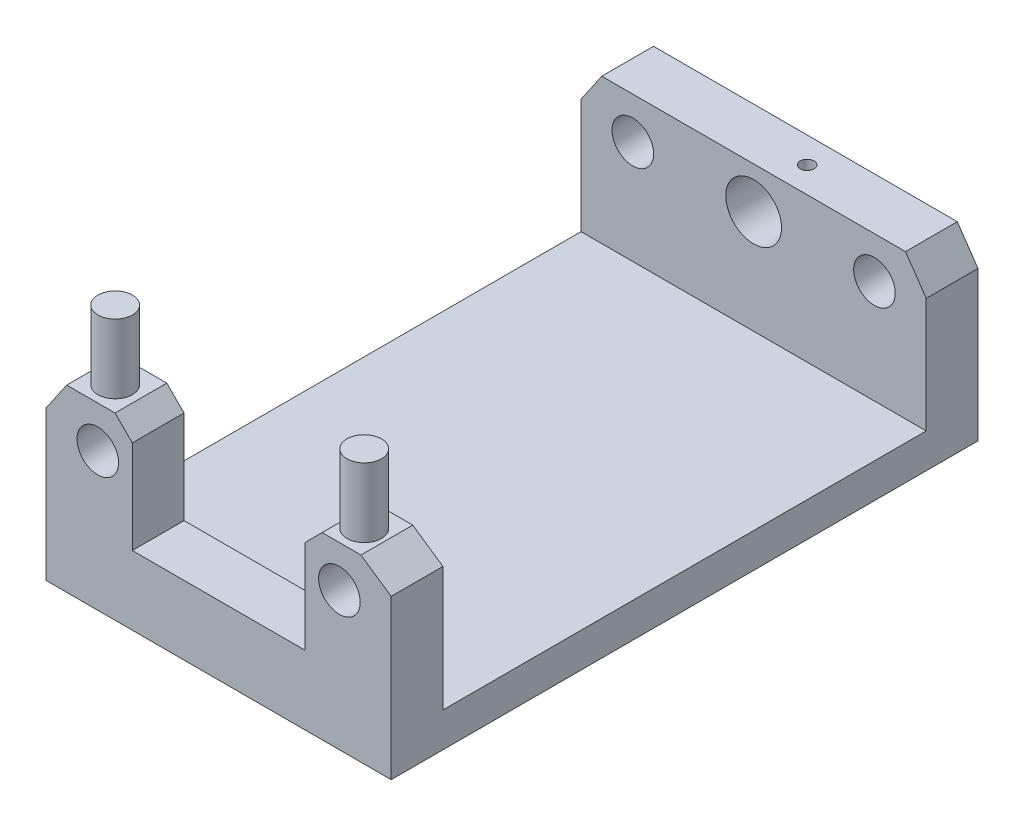
from build123d import *
from OCP.BRepFilletAPI import BRepFilletAPI_MakeChamfer

# Parameters (mm, degrees)
SKETCH1_W                      = 100
SKETCH1_H                      = 52
BOSS_EXTRUDE1_DEPTH            = 15
SKETCH2_R                      = 6
BOSS_EXTRUDE2_DEPTH            = 140
SKETCH3_W                      = 100
SKETCH3_H                      = 46
BOSS_EXTRUDE3_DEPTH            = 15
SKETCH4_W                      = 100
SKETCH4_H                      = 15
BOSS_EXTRUDE4_DEPTH            = 6
SKETCH5_W                      = 100
SKETCH5_H                      = 10
BOSS_EXTRUDE5_DEPTH            = 30
SKETCH6_W                      = 100
SKETCH6_H                      = 10
BOSS_EXTRUDE6_DEPTH            = 30
SKETCH7_W                      = 50
SKETCH7_H                      = 32
CUT_EXTRUDE1_DEPTH             = 168.705098312
SKETCH8_W                      = 6
SKETCH8_H                      = 1
SKETCH9_W                      = 6
SKETCH9_H                      = 1
SKETCH10_W                     = 6
SKETCH10_H                     = 1
SKETCH11_W                     = 6
SKETCH11_H                     = 1
SKETCH12_W                     = 6
SKETCH12_H                     = 140
F_10_0_10_DIAMETER_HOLE1_D     = 10
F_10_0_10_DIAMETER_HOLE1_DEPTH = 10
F_4_0_4_DIAMETER_HOLE1_D       = 4
F_4_0_4_DIAMETER_HOLE1_DEPTH   = 20
F_16_0_16_DIAMETER_HOLE1_D     = 16
F_16_0_16_DIAMETER_HOLE1_DEPTH = 16
CHAMFER1_SIZE                  = 8.75
CHAMFER1_SIZE2                 = 6
CHAMFER2_SIZE                  = 5
SKETCH19_R                     = 6
CUT_EXTRUDE2_DEPTH             = 300
SKETCH20_W                     = 80
SKETCH20_H                     = 10
BOSS_EXTRUDE7_DEPTH            = 100
SKETCH21_R                     = 5
BOSS_EXTRUDE8_DEPTH            = 10
SKETCH23_R                     = 5
BOSS_EXTRUDE10_DEPTH           = 20
SKETCH24_R                     = 8.075
CUT_EXTRUDE3_DEPTH             = 40
SKETCH25_R                     = 6.025
CUT_EXTRUDE4_DEPTH             = 187


with BuildPart() as part:
    # Sketch1 → Boss-Extrude1 (new body)
    with BuildSketch(Plane.XY.offset(85)):
        with Locations((0, -14)):
            Rectangle(SKETCH1_W, SKETCH1_H)
    extrude(amount=-BOSS_EXTRUDE1_DEPTH)

    # Sketch2 → Boss-Extrude2 (add)
    with BuildSketch(Plane(origin=(0, 0, 70), x_dir=(-1, 0, 0), z_dir=(0, 0, -1))):
        with Locations(Location((35, 0, 0), (0, 0, 180))):
            Circle(SKETCH2_R)
    extrude(amount=BOSS_EXTRUDE2_DEPTH)

    # Sketch3 → Boss-Extrude3 (add)
    with BuildSketch(Plane.XY.offset(-70)):
        with Locations((0, -17)):
            Rectangle(SKETCH3_W, SKETCH3_H)
    extrude(amount=-BOSS_EXTRUDE3_DEPTH)

    # Sketch4 → Boss-Extrude4 (add)
    with BuildSketch(Plane(origin=(0, 6, 0), x_dir=(-1, 0, 0), z_dir=(0, 1, 0))):
        with Locations((0, -77.5)):
            Rectangle(SKETCH4_W, SKETCH4_H)
    extrude(amount=BOSS_EXTRUDE4_DEPTH)

    # Sketch5 → Boss-Extrude5 (add)
    with BuildSketch(Plane(origin=(0, 0, 70), x_dir=(-1, 0, 0), z_dir=(0, 0, -1))):
        with Locations((0, -35)):
            Rectangle(SKETCH5_W, SKETCH5_H)
    extrude(amount=BOSS_EXTRUDE5_DEPTH)

    # Sketch6 → Boss-Extrude6 (add)
    with BuildSketch(Plane.XY.offset(-70)):
        with Locations((0, -35)):
            Rectangle(SKETCH6_W, SKETCH6_H)
    extrude(amount=BOSS_EXTRUDE6_DEPTH)

    # Sketch7 → Cut-Extrude1 (cut, through all)
    with BuildSketch(Plane(origin=(0, 0, 70), x_dir=(-1, 0, 0), z_dir=(0, 0, -1))):
        with Locations((0, -4)):
            Rectangle(SKETCH7_W, SKETCH7_H)
    extrude(amount=-CUT_EXTRUDE1_DEPTH, mode=Mode.SUBTRACT)

    # Sketch8 → Revolve1 (revolve)
    with BuildSketch(Plane(origin=(0, 0, 0), x_dir=(1, 0, 0), z_dir=(0, 1, 0))):
        with Locations((38, 85.5)):
            Rectangle(SKETCH8_W, SKETCH8_H)
    revolve(axis=Axis((35, 0, -86), (0, 0, 1)))

    # Sketch9 → Revolve2 (revolve)
    with BuildSketch(Plane(origin=(0, 0, 0), x_dir=(1, 0, 0), z_dir=(0, 1, 0))):
        with Locations((-32, 85.5)):
            Rectangle(SKETCH9_W, SKETCH9_H)
    revolve(axis=Axis((-35, 0, -86), (0, 0, 1)))

    # Sketch10 → Revolve3 (revolve)
    with BuildSketch(Plane(origin=(0, 0, 0), x_dir=(1, 0, 0), z_dir=(0, 1, 0))):
        with Locations((38, -85.5)):
            Rectangle(SKETCH10_W, SKETCH10_H)
    revolve(axis=Axis((35, 0, 85), (0, 0, 1)))

    # Sketch11 → Revolve4 (revolve)
    with BuildSketch(Plane(origin=(0, 0, 0), x_dir=(1, 0, 0), z_dir=(0, 1, 0))):
        with Locations((-32, -85.5)):
            Rectangle(SKETCH11_W, SKETCH11_H)
    revolve(axis=Axis((-35, 0, 85), (0, 0, 1)))

    # Sketch12 → Revolve5 (revolve)
    with BuildSketch(Plane(origin=(0, 0, 0), x_dir=(1, 0, 0), z_dir=(0, 1, 0))):
        with Locations((38, 0)):
            Rectangle(SKETCH12_W, SKETCH12_H)
    revolve(axis=Axis((35, 0, -70), (0, 0, 1)))

    # Ø10.0 (10) Diameter Hole1
    with Locations(Plane(origin=(0, -40, 0), x_dir=(-1, 0, 0), z_dir=(0, -1, 0))):
        with Locations((35, -55), (-35, -55), (-35, 54.99817447), (35, 54.99817447)):
            Hole(F_10_0_10_DIAMETER_HOLE1_D / 2, depth=F_10_0_10_DIAMETER_HOLE1_DEPTH)

    # Ø4.0 (4) Diameter Hole1
    with Locations(Plane(origin=(0, 12, 0), x_dir=(1, 0, 0), z_dir=(0, 1, 0))):
        with Locations((8, 77.5)):
            Hole(F_4_0_4_DIAMETER_HOLE1_D / 2, depth=F_4_0_4_DIAMETER_HOLE1_DEPTH)

    # Ø16.0 (16) Diameter Hole1
    with Locations(Plane.XY.offset(-70)):
        with Locations((0, 0)):
            Hole(F_16_0_16_DIAMETER_HOLE1_D / 2, depth=F_16_0_16_DIAMETER_HOLE1_DEPTH)

    # Chamfer1: one chamfer whose edges measure the first distance from different faces: ONE call of the kernel's chamfer builder (chamfer() names one face for all edges)
    chamfer1_edges_1 = [part.edges().sort_by_distance(p)[0] for p in [
        (50, 12, -77.5),
    ]]
    chamfer1_side_1 = [part.faces().sort_by_distance(p)[0] for p in [
        (50, -19.833333333, -71.25),
    ]]
    chamfer1_edges_2 = [part.edges().sort_by_distance(p)[0] for p in [
        (-50, 12, -77.5),
    ]]
    chamfer1_side_2 = [part.faces().sort_by_distance(p)[0] for p in [
        (-50, -19.833333333, -71.25),
    ]]
    chamfer1_edges_3 = [part.edges().sort_by_distance(p)[0] for p in [
        (-50, 12, 77.5),
    ]]
    chamfer1_side_3 = [part.faces().sort_by_distance(p)[0] for p in [
        (-50, -19.833333333, 71.25),
    ]]
    chamfer1_edges_4 = [part.edges().sort_by_distance(p)[0] for p in [
        (50, 12, 77.5),
    ]]
    chamfer1_side_4 = [part.faces().sort_by_distance(p)[0] for p in [
        (37.5, 12, 77.5),
    ]]
    chamfer1 = BRepFilletAPI_MakeChamfer(part.part.solid().wrapped)
    for e in chamfer1_edges_1:
        chamfer1.Add(CHAMFER1_SIZE, CHAMFER1_SIZE2, e.wrapped, chamfer1_side_1[0].wrapped)  # the first distance lies on this face
    for e in chamfer1_edges_2:
        chamfer1.Add(CHAMFER1_SIZE, CHAMFER1_SIZE2, e.wrapped, chamfer1_side_2[0].wrapped)  # the first distance lies on this face
    for e in chamfer1_edges_3:
        chamfer1.Add(CHAMFER1_SIZE, CHAMFER1_SIZE2, e.wrapped, chamfer1_side_3[0].wrapped)  # the first distance lies on this face
    for e in chamfer1_edges_4:
        chamfer1.Add(CHAMFER1_SIZE, CHAMFER1_SIZE2, e.wrapped, chamfer1_side_4[0].wrapped)  # the first distance lies on this face
    add(Compound.cast(chamfer1.Shape()), mode=Mode.REPLACE)

    # Chamfer2
    chamfer2_edges = [part.edges().sort_by_distance(p)[0] for p in [
        (-25, 12, 77.5),
        (25, 12, 77.5),
    ]]
    chamfer(chamfer2_edges, length=CHAMFER2_SIZE)

    # Sketch19 → Cut-Extrude2 (cut)
    with BuildSketch(Plane(origin=(0, 0, -86), x_dir=(-1, 0, 0), z_dir=(0, 0, -1))):
        with Locations(Location((-35, 0, 0), (0, 0, 180))):
            Circle(SKETCH19_R)
        with Locations(Location((35, 0, 0), (0, 0, 180))):
            Circle(SKETCH19_R)
    extrude(amount=-CUT_EXTRUDE2_DEPTH, mode=Mode.SUBTRACT)


with BuildPart() as cut_extrude2_piece_1:
    # of the separate pieces the step leaves, piece 1, a body of its own (cut_extrude2_pieces)
    add(part.part.solids().sort_by_distance((-50, 3.25, -70))[0])



with BuildPart() as cut_extrude2_piece_2:
    # of the separate pieces the step leaves, piece 2, a body of its own (cut_extrude2_pieces)
    add(part.part.solids().sort_by_distance((30, 12, 70))[0])


with BuildPart() as cut_extrude2_piece_1_1:
    add(cut_extrude2_piece_1.part)

    add(cut_extrude2_piece_2.part)  # Boss-Extrude7 merges Cut-Extrude2 piece 2
    # Sketch20 → Boss-Extrude7 (add)
    with BuildSketch(Plane.ZY.offset(50)):
        with Locations((0, -35)):
            Rectangle(SKETCH20_W, SKETCH20_H)
    extrude(amount=-BOSS_EXTRUDE7_DEPTH)

    # Sketch21 → Boss-Extrude8 (add)
    with BuildSketch(Plane(origin=(0, -30, 0), x_dir=(1, 0, 0), z_dir=(0, 1, 0))):
        with Locations((-35, 54.99817447)):
            Circle(SKETCH21_R)
        with Locations((35, 54.99817447)):
            Circle(SKETCH21_R)
        with Locations((35, -55)):
            Circle(SKETCH21_R)
        with Locations((-35, -55)):
            Circle(SKETCH21_R)
    extrude(amount=-BOSS_EXTRUDE8_DEPTH)

    # Sketch23 → Boss-Extrude10 (add)
    with BuildSketch(Plane(origin=(0, 12, 0), x_dir=(1, 0, 0), z_dir=(0, 1, 0))):
        with Locations(Location((-37.07435596, -77.890606879, 0), (0, 0, 270))):
            Circle(SKETCH23_R)
        with Locations(Location((35.083214943, -77.890606879, 0), (0, 0, 270))):
            Circle(SKETCH23_R)
    extrude(amount=BOSS_EXTRUDE10_DEPTH)

    # Sketch24 → Cut-Extrude3 (cut)
    with BuildSketch(Plane(origin=(0, 0, -85), x_dir=(-1, 0, 0), z_dir=(0, 0, -1))):
        Circle(SKETCH24_R)
    extrude(amount=-CUT_EXTRUDE3_DEPTH, mode=Mode.SUBTRACT)

    # Sketch25 → Cut-Extrude4 (cut)
    with BuildSketch(Plane.XY.offset(85)):
        with Locations((-35, 0)):
            Circle(SKETCH25_R)
        with Locations((35, 0)):
            Circle(SKETCH25_R)
    extrude(amount=-CUT_EXTRUDE4_DEPTH, mode=Mode.SUBTRACT)


solid = cut_extrude2_piece_1_1.part
